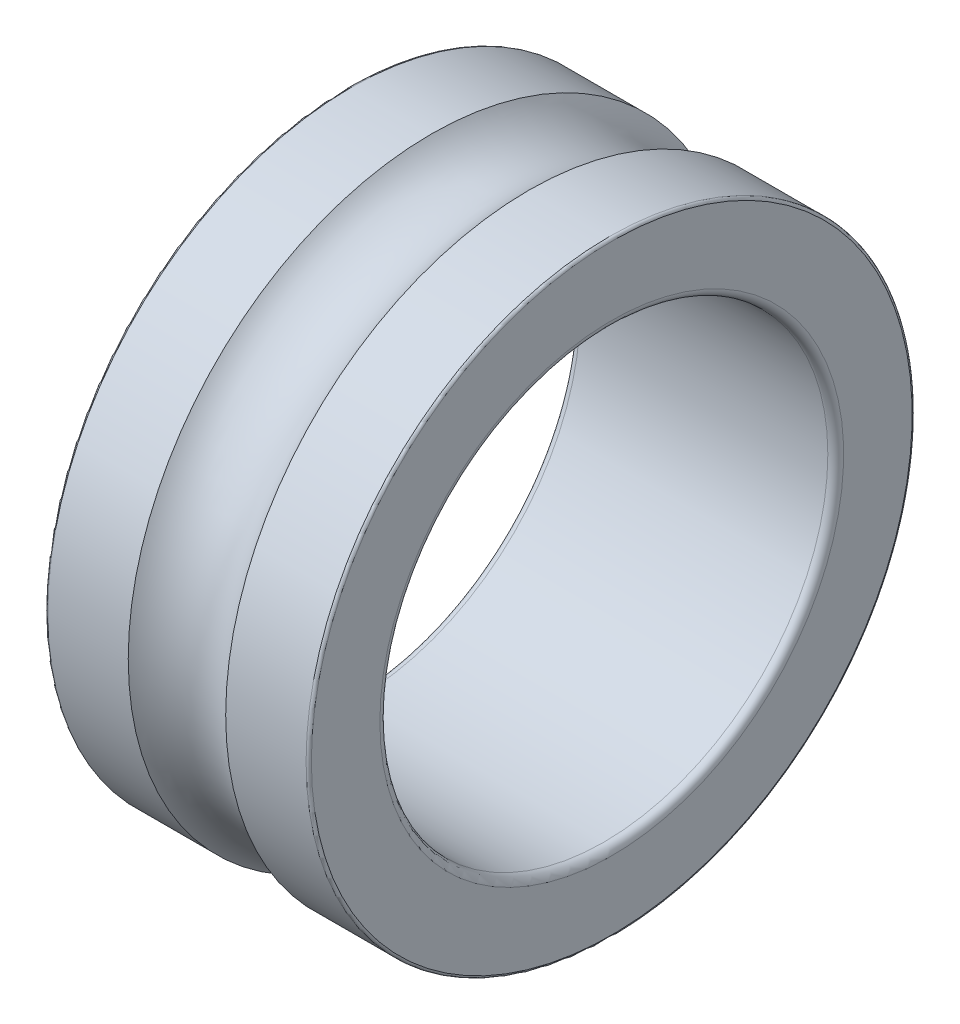
from build123d import *


with BuildPart() as part:
    # Esquisse1 → Révolution1 (revolve)
    with BuildSketch(Plane.XY, mode=Mode.PRIVATE) as r_volution1_sk:
        with BuildLine():
            Line((0.3, 8.5), (9.7, 8.5))
            ThreePointArc((9.7, 8.5), (9.912132034, 8.587867966), (10, 8.8))
            Line((10, 8.8), (10, 11.4))
            ThreePointArc((10, 11.4), (9.970710678, 11.470710678), (9.9, 11.5))
            Line((9.9, 11.5), (6.849097347, 11.5))
            ThreePointArc((6.849097347, 11.5), (5, 10.619), (3.150902653, 11.5))
            Line((3.150902653, 11.5), (0.1, 11.5))
            ThreePointArc((0.1, 11.5), (0.029289322, 11.470710678), (0, 11.4))
            Line((0, 11.4), (0, 8.8))
            ThreePointArc((0, 8.8), (0.087867966, 8.587867966), (0.3, 8.5))
        make_face()
    revolve(r_volution1_sk.sketch.rotate(Axis((100, 0, 0), (-1, 0, 0)), 270), axis=Axis((100, 0, 0), (-1, 0, 0)))


solid = part.part
